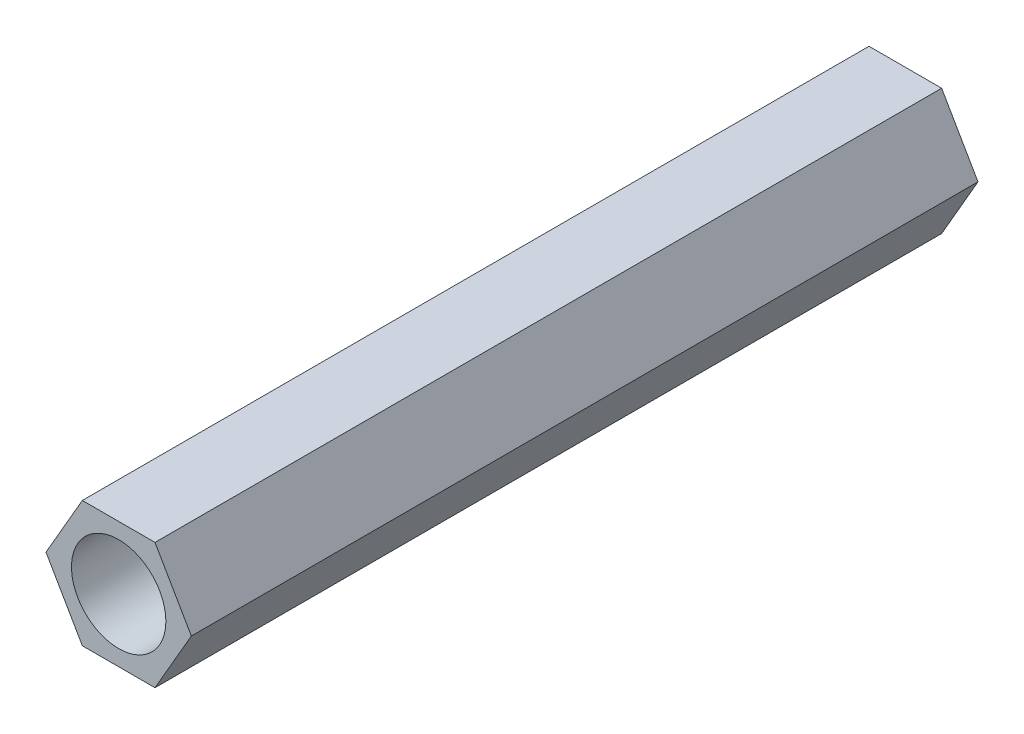
from build123d import *

# Parameters (mm, degrees)
SKETCH_1_R      = 1.5
EXTRUDE_1_DEPTH = 25


with BuildPart() as part:
    # 草图1 → 凸台-拉伸1 (new body)
    with BuildSketch(Plane.XY):
        Polygon((2.309401077, 0), (1.154700538, 2), (-1.154700538, 2), (-2.309401077, 0), (-1.154700538, -2), (1.154700538, -2), align=None)
        Circle(SKETCH_1_R, mode=Mode.SUBTRACT)
    extrude(amount=EXTRUDE_1_DEPTH)


solid = part.part
